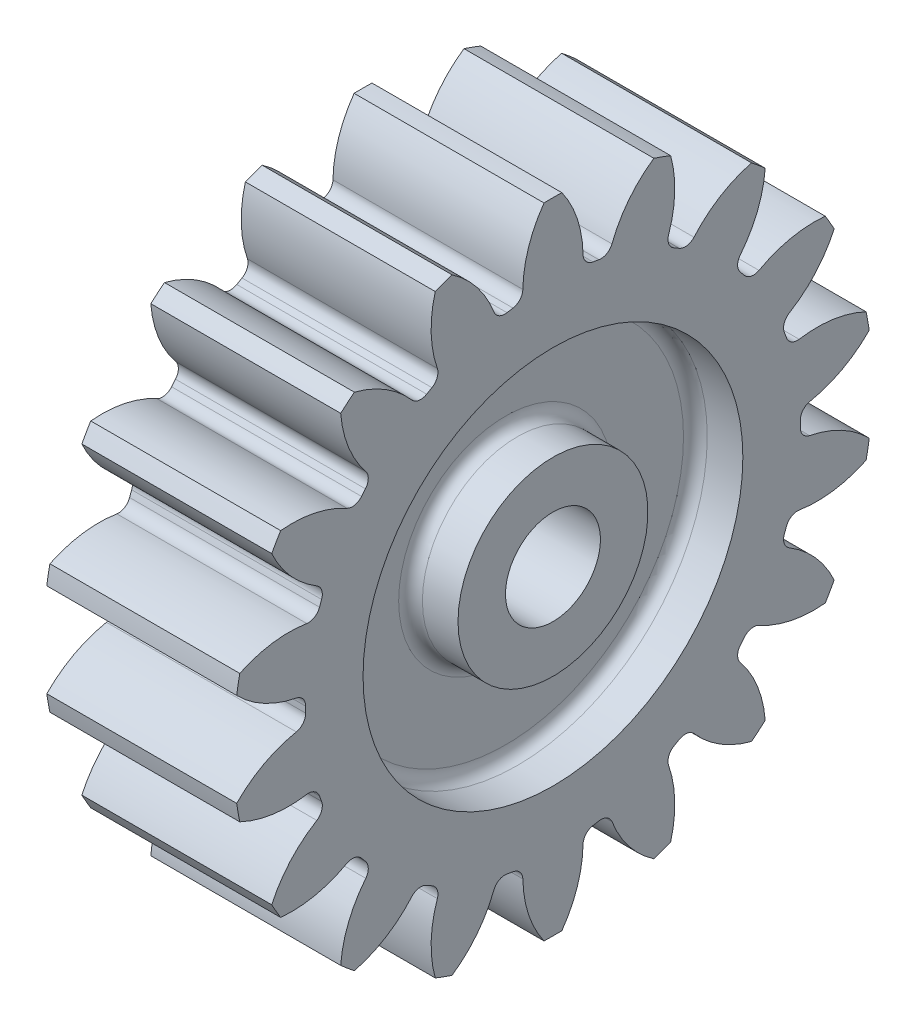
from build123d import *

# Parameters (mm, degrees)
CUT_EXTRUDE2_DEPTH      = 66.590770217
CUT_EXTRUDE2_DEPTH_BACK = 66.590770217


with BuildPart() as part:
    # Sketch1 → Revolve1 (revolve)
    with BuildSketch(Plane.XY, mode=Mode.PRIVATE) as revolve1_sk:
        with BuildLine():
            Line((12.7, 42.7609), (-12.7, 42.7609))
            Line((-12.7, 42.7609), (-12.7, 25.4))
            Line((-12.7, 25.4), (-7.9375, 25.4))
            ThreePointArc((-7.9375, 25.4), (-6.814967985, 24.935032015), (-6.35, 23.8125))
            Line((-6.35, 23.8125), (-6.35, 14.2875))
            ThreePointArc((-6.35, 14.2875), (-6.814967985, 13.164967985), (-7.9375, 12.7))
            Line((-7.9375, 12.7), (-12.7, 12.7))
            Line((-12.7, 12.7), (-12.7, 6.35))
            Line((-12.7, 6.35), (12.7, 6.35))
            Line((12.7, 6.35), (12.7, 12.7))
            Line((12.7, 12.7), (7.9375, 12.7))
            ThreePointArc((7.9375, 12.7), (6.814967985, 13.164967985), (6.35, 14.2875))
            Line((6.35, 14.2875), (6.35, 23.8125))
            ThreePointArc((6.35, 23.8125), (6.814967985, 24.935032015), (7.9375, 25.4))
            Line((7.9375, 25.4), (12.7, 25.4))
            Line((12.7, 25.4), (12.7, 42.7609))
        make_face()
    revolve(revolve1_sk.sketch.rotate(Axis((-34.982581394, 0, 0), (1, 0, 0)), 90), axis=Axis((-34.982581394, 0, 0), (1, 0, 0)))

    # Sketch2 → Cut-Extrude2 (cut, two sides: drawn at the far end of the back side and taken through both)
    with BuildSketch(Plane(origin=(12.7, 0, 0), x_dir=(0, 0, -1), z_dir=(1, 0, 0)).offset(-CUT_EXTRUDE2_DEPTH_BACK)):
        with BuildLine():
            ThreePointArc((-5.346216013, -32.6486745), (-5.744889486, -32.580887297), (-6.142704595, -32.508232073))
            ThreePointArc((-6.142704595, -32.508232073), (-7.188622848, -32.672825156), (-7.893925966, -33.462498119))
            ThreePointArc((-7.893925966, -33.462498119), (-7.904401835, -33.489776906), (-7.914929989, -33.517035556))
            ThreePointArc((-7.914929989, -33.517035556), (-10.173518502, -37.467321782), (-13.497693879, -40.574706761))
            ThreePointArc((-13.497693879, -40.574706761), (-7.42535236, -42.111265846), (-1.193683686, -42.744235729))
            ThreePointArc((-1.193683686, -42.744235729), (-3.254598502, -38.687314056), (-4.0259, -34.202776472))
            ThreePointArc((-4.0259, -34.202776472), (-4.026470221, -34.173560879), (-4.026984424, -34.144344246))
            ThreePointArc((-4.026984424, -34.144344246), (-4.419668498, -33.161066516), (-5.346216013, -32.6486745))
        make_face()
        with BuildLine():
            ThreePointArc((-16.190304069, -28.851204939), (-16.54175, -28.651151446), (-16.890724373, -28.446817088))
            ThreePointArc((-16.890724373, -28.446817088), (-17.929860187, -28.243758882), (-18.862712382, -28.744580865))
            ThreePointArc((-18.862712382, -28.744580865), (-18.881886373, -28.766631582), (-18.90110261, -28.788645494))
            ThreePointArc((-18.90110261, -28.788645494), (-22.37455903, -31.728217543), (-26.561050358, -33.511269339))
            ThreePointArc((-26.561050358, -33.511269339), (-21.38045, -37.032025689), (-15.741085382, -39.75817903))
            ThreePointArc((-15.741085382, -39.75817903), (-16.290162894, -35.24104529), (-15.481147033, -30.763157766))
            ThreePointArc((-15.481147033, -30.763157766), (-15.471690544, -30.735509061), (-15.46218106, -30.707878539))
            ThreePointArc((-15.46218106, -30.707878539), (-15.494882597, -29.649593849), (-16.190304069, -28.851204939))
        make_face()
        with BuildLine():
            ThreePointArc((-25.08160251, -21.573854264), (-25.343431334, -21.265663885), (-25.60147351, -20.954296131))
            ThreePointArc((-25.60147351, -20.954296131), (-26.50849177, -20.408078454), (-27.5563773, -20.559642934))
            ThreePointArc((-27.5563773, -20.559642934), (-27.581936748, -20.573805939), (-27.607523305, -20.587919909))
            ThreePointArc((-27.607523305, -20.587919909), (-31.876897526, -22.16222201), (-36.420752164, -22.405878261))
            ThreePointArc((-36.420752164, -22.405878261), (-32.756749828, -27.486176699), (-28.389879867, -31.976699172))
            ThreePointArc((-28.389879867, -31.976699172), (-27.360893224, -27.54418636), (-25.069139257, -23.613048218))
            ThreePointArc((-25.069139257, -23.613048218), (-25.05079665, -23.590301244), (-25.032410462, -23.567589481))
            ThreePointArc((-25.032410462, -23.567589481), (-24.701185174, -22.561942583), (-25.08160251, -21.573854264))
        make_face()
        with BuildLine():
            ThreePointArc((-30.947689523, -11.694378368), (-31.08832082, -11.315223412), (-31.224307105, -10.934377809))
            ThreePointArc((-31.224307105, -10.934377809), (-31.889808023, -10.110882573), (-32.926336428, -9.894908638))
            ThreePointArc((-32.926336428, -9.894908638), (-32.955198485, -9.899475662), (-32.984069246, -9.903987338))
            ThreePointArc((-32.984069246, -9.903987338), (-37.534411727, -9.923135422), (-41.887573746, -8.598007589))
            ThreePointArc((-41.887573746, -8.598007589), (-40.182102188, -14.625089147), (-37.61443585, -20.338357468))
            ThreePointArc((-37.61443585, -20.338357468), (-35.131496028, -16.525092046), (-31.633423305, -13.614856563))
            ThreePointArc((-31.633423305, -13.614856563), (-31.608406969, -13.59975494), (-31.583361724, -13.584701311))
            ThreePointArc((-31.583361724, -13.584701311), (-30.928160269, -12.752988062), (-30.947689523, -11.694378368))
        make_face()
        with BuildLine():
            ThreePointArc((-33.081028441, -0.404387851), (-33.0835, 0), (-33.081028441, 0.404387851))
            ThreePointArc((-33.081028441, 0.404387851), (-33.424742784, 1.405834967), (-34.324893441, 1.963297674))
            ThreePointArc((-34.324893441, 1.963297674), (-34.353576918, 1.96887748), (-34.382249643, 1.974512273))
            ThreePointArc((-34.382249643, 1.974512273), (-38.664721924, 3.512827747), (-42.302135739, 6.246909692))
            ThreePointArc((-42.302135739, 6.246909692), (-42.7609, 0), (-42.302135739, -6.246909692))
            ThreePointArc((-42.302135739, -6.246909692), (-38.664721924, -3.512827747), (-34.382249643, -1.974512273))
            ThreePointArc((-34.382249643, -1.974512273), (-34.353576918, -1.96887748), (-34.324893441, -1.963297674))
            ThreePointArc((-34.324893441, -1.963297674), (-33.424742784, -1.405834967), (-33.081028441, -0.404387851))
        make_face()
        with BuildLine():
            ThreePointArc((-31.224307105, 10.934377809), (-31.08832082, 11.315223412), (-30.947689523, 11.694378368))
            ThreePointArc((-30.947689523, 11.694378368), (-30.928160269, 12.752988062), (-31.583361724, 13.584701311))
            ThreePointArc((-31.583361724, 13.584701311), (-31.608406969, 13.59975494), (-31.633423305, 13.614856563))
            ThreePointArc((-31.633423305, 13.614856563), (-35.131496028, 16.525092046), (-37.61443585, 20.338357468))
            ThreePointArc((-37.61443585, 20.338357468), (-40.182102188, 14.625089147), (-41.887573746, 8.598007589))
            ThreePointArc((-41.887573746, 8.598007589), (-37.534411727, 9.923135422), (-32.984069246, 9.903987338))
            ThreePointArc((-32.984069246, 9.903987338), (-32.955198485, 9.899475662), (-32.926336428, 9.894908638))
            ThreePointArc((-32.926336428, 9.894908638), (-31.889808023, 10.110882573), (-31.224307105, 10.934377809))
        make_face()
        with BuildLine():
            ThreePointArc((-25.069139257, 23.613048218), (-27.360893224, 27.54418636), (-28.389879867, 31.976699172))
            ThreePointArc((-28.389879867, 31.976699172), (-32.756749828, 27.486176699), (-36.420752164, 22.405878261))
            ThreePointArc((-36.420752164, 22.405878261), (-31.876897526, 22.16222201), (-27.607523305, 20.587919909))
            ThreePointArc((-27.607523305, 20.587919909), (-27.581936748, 20.573805939), (-27.5563773, 20.559642934))
            ThreePointArc((-27.5563773, 20.559642934), (-26.50849177, 20.408078454), (-25.60147351, 20.954296131))
            ThreePointArc((-25.60147351, 20.954296131), (-25.343431334, 21.265663885), (-25.08160251, 21.573854264))
            ThreePointArc((-25.08160251, 21.573854264), (-24.701185174, 22.561942583), (-25.032410462, 23.567589481))
            ThreePointArc((-25.032410462, 23.567589481), (-25.05079665, 23.590301244), (-25.069139257, 23.613048218))
        make_face()
        with BuildLine():
            ThreePointArc((-15.481147033, 30.763157766), (-16.290162894, 35.24104529), (-15.741085382, 39.75817903))
            ThreePointArc((-15.741085382, 39.75817903), (-21.38045, 37.032025689), (-26.561050358, 33.511269339))
            ThreePointArc((-26.561050358, 33.511269339), (-22.37455903, 31.728217543), (-18.90110261, 28.788645494))
            ThreePointArc((-18.90110261, 28.788645494), (-18.881886373, 28.766631582), (-18.862712382, 28.744580865))
            ThreePointArc((-18.862712382, 28.744580865), (-17.929860187, 28.243758882), (-16.890724373, 28.446817088))
            ThreePointArc((-16.890724373, 28.446817088), (-16.54175, 28.651151446), (-16.190304069, 28.851204939))
            ThreePointArc((-16.190304069, 28.851204939), (-15.494882597, 29.649593849), (-15.46218106, 30.707878539))
            ThreePointArc((-15.46218106, 30.707878539), (-15.471690544, 30.735509061), (-15.481147033, 30.763157766))
        make_face()
        with BuildLine():
            ThreePointArc((-4.0259, 34.202776472), (-3.254598502, 38.687314056), (-1.193683686, 42.744235729))
            ThreePointArc((-1.193683686, 42.744235729), (-7.42535236, 42.111265846), (-13.497693879, 40.574706761))
            ThreePointArc((-13.497693879, 40.574706761), (-10.173518502, 37.467321782), (-7.914929989, 33.517035556))
            ThreePointArc((-7.914929989, 33.517035556), (-7.904401835, 33.489776906), (-7.893925966, 33.462498119))
            ThreePointArc((-7.893925966, 33.462498119), (-7.188622848, 32.672825156), (-6.142704595, 32.508232073))
            ThreePointArc((-6.142704595, 32.508232073), (-5.744889486, 32.580887297), (-5.346216013, 32.6486745))
            ThreePointArc((-5.346216013, 32.6486745), (-4.419668498, 33.161066516), (-4.026984424, 34.144344246))
            ThreePointArc((-4.026984424, 34.144344246), (-4.026470221, 34.173560879), (-4.0259, 34.202776472))
        make_face()
        with BuildLine():
            ThreePointArc((13.497693879, 40.574706761), (7.42535236, 42.111265846), (1.193683686, 42.744235729))
            ThreePointArc((1.193683686, 42.744235729), (3.254598502, 38.687314056), (4.0259, 34.202776472))
            ThreePointArc((4.0259, 34.202776472), (4.026470221, 34.173560879), (4.026984424, 34.144344246))
            ThreePointArc((4.026984424, 34.144344246), (4.419668498, 33.161066516), (5.346216013, 32.6486745))
            ThreePointArc((5.346216013, 32.6486745), (5.744889486, 32.580887297), (6.142704595, 32.508232073))
            ThreePointArc((6.142704595, 32.508232073), (7.188622848, 32.672825156), (7.893925966, 33.462498119))
            ThreePointArc((7.893925966, 33.462498119), (7.904401835, 33.489776906), (7.914929989, 33.517035556))
            ThreePointArc((7.914929989, 33.517035556), (10.173518502, 37.467321782), (13.497693879, 40.574706761))
        make_face()
        with BuildLine():
            ThreePointArc((26.561050358, 33.511269339), (21.38045, 37.032025689), (15.741085382, 39.75817903))
            ThreePointArc((15.741085382, 39.75817903), (16.290162894, 35.24104529), (15.481147033, 30.763157766))
            ThreePointArc((15.481147033, 30.763157766), (15.471690544, 30.735509061), (15.46218106, 30.707878539))
            ThreePointArc((15.46218106, 30.707878539), (15.494882597, 29.649593849), (16.190304069, 28.851204939))
            ThreePointArc((16.190304069, 28.851204939), (16.54175, 28.651151446), (16.890724373, 28.446817088))
            ThreePointArc((16.890724373, 28.446817088), (17.929860187, 28.243758882), (18.862712382, 28.744580865))
            ThreePointArc((18.862712382, 28.744580865), (18.881886373, 28.766631582), (18.90110261, 28.788645494))
            ThreePointArc((18.90110261, 28.788645494), (22.37455903, 31.728217543), (26.561050358, 33.511269339))
        make_face()
        with BuildLine():
            ThreePointArc((36.420752164, 22.405878261), (32.756749828, 27.486176699), (28.389879867, 31.976699172))
            ThreePointArc((28.389879867, 31.976699172), (27.360893224, 27.54418636), (25.069139257, 23.613048218))
            ThreePointArc((25.069139257, 23.613048218), (25.05079665, 23.590301244), (25.032410462, 23.567589481))
            ThreePointArc((25.032410462, 23.567589481), (24.701185174, 22.561942583), (25.08160251, 21.573854264))
            ThreePointArc((25.08160251, 21.573854264), (25.343431334, 21.265663885), (25.60147351, 20.954296131))
            ThreePointArc((25.60147351, 20.954296131), (26.50849177, 20.408078454), (27.5563773, 20.559642934))
            ThreePointArc((27.5563773, 20.559642934), (27.581936748, 20.573805939), (27.607523305, 20.587919909))
            ThreePointArc((27.607523305, 20.587919909), (31.876897526, 22.16222201), (36.420752164, 22.405878261))
        make_face()
        with BuildLine():
            ThreePointArc((31.583361724, 13.584701311), (30.928160269, 12.752988062), (30.947689523, 11.694378368))
            ThreePointArc((30.947689523, 11.694378368), (31.08832082, 11.315223412), (31.224307105, 10.934377809))
            ThreePointArc((31.224307105, 10.934377809), (31.889808023, 10.110882573), (32.926336428, 9.894908638))
            ThreePointArc((32.926336428, 9.894908638), (32.955198485, 9.899475662), (32.984069246, 9.903987338))
            ThreePointArc((32.984069246, 9.903987338), (37.534411727, 9.923135422), (41.887573746, 8.598007589))
            ThreePointArc((41.887573746, 8.598007589), (40.182102188, 14.625089147), (37.61443585, 20.338357468))
            ThreePointArc((37.61443585, 20.338357468), (35.131496028, 16.525092046), (31.633423305, 13.614856563))
            ThreePointArc((31.633423305, 13.614856563), (31.608406969, 13.59975494), (31.583361724, 13.584701311))
        make_face()
        with BuildLine():
            ThreePointArc((34.324893441, 1.963297674), (33.424742784, 1.405834967), (33.081028441, 0.404387851))
            ThreePointArc((33.081028441, 0.404387851), (33.082882104, 0.202197702), (33.0835, 0))
            ThreePointArc((33.0835, 0), (33.082882104, -0.202197702), (33.081028441, -0.404387851))
            ThreePointArc((33.081028441, -0.404387851), (33.424742784, -1.405834967), (34.324893441, -1.963297674))
            ThreePointArc((34.324893441, -1.963297674), (34.353576918, -1.96887748), (34.382249643, -1.974512273))
            ThreePointArc((34.382249643, -1.974512273), (38.664721924, -3.512827747), (42.302135739, -6.246909692))
            ThreePointArc((42.302135739, -6.246909692), (42.646054712, -3.13186627), (42.7609, 0))
            ThreePointArc((42.7609, 0), (42.646054712, 3.13186627), (42.302135739, 6.246909692))
            ThreePointArc((42.302135739, 6.246909692), (38.664721924, 3.512827747), (34.382249643, 1.974512273))
            ThreePointArc((34.382249643, 1.974512273), (34.353576918, 1.96887748), (34.324893441, 1.963297674))
        make_face()
        with BuildLine():
            ThreePointArc((32.926336428, -9.894908638), (31.889808023, -10.110882573), (31.224307105, -10.934377809))
            ThreePointArc((31.224307105, -10.934377809), (31.08832082, -11.315223412), (30.947689523, -11.694378368))
            ThreePointArc((30.947689523, -11.694378368), (30.928160269, -12.752988062), (31.583361724, -13.584701311))
            ThreePointArc((31.583361724, -13.584701311), (31.608406969, -13.59975494), (31.633423305, -13.614856563))
            ThreePointArc((31.633423305, -13.614856563), (35.131496028, -16.525092046), (37.61443585, -20.338357468))
            ThreePointArc((37.61443585, -20.338357468), (40.182102188, -14.625089147), (41.887573746, -8.598007589))
            ThreePointArc((41.887573746, -8.598007589), (37.534411727, -9.923135422), (32.984069246, -9.903987338))
            ThreePointArc((32.984069246, -9.903987338), (32.955198485, -9.899475662), (32.926336428, -9.894908638))
        make_face()
        with BuildLine():
            ThreePointArc((27.5563773, -20.559642934), (26.50849177, -20.408078454), (25.60147351, -20.954296131))
            ThreePointArc((25.60147351, -20.954296131), (25.343431334, -21.265663885), (25.08160251, -21.573854264))
            ThreePointArc((25.08160251, -21.573854264), (24.701185174, -22.561942583), (25.032410462, -23.567589481))
            ThreePointArc((25.032410462, -23.567589481), (25.05079665, -23.590301244), (25.069139257, -23.613048218))
            ThreePointArc((25.069139257, -23.613048218), (27.360893224, -27.54418636), (28.389879867, -31.976699172))
            ThreePointArc((28.389879867, -31.976699172), (32.756749828, -27.486176699), (36.420752164, -22.405878261))
            ThreePointArc((36.420752164, -22.405878261), (31.876897526, -22.16222201), (27.607523305, -20.587919909))
            ThreePointArc((27.607523305, -20.587919909), (27.581936748, -20.573805939), (27.5563773, -20.559642934))
        make_face()
        with BuildLine():
            ThreePointArc((18.862712382, -28.744580865), (17.929860187, -28.243758882), (16.890724373, -28.446817088))
            ThreePointArc((16.890724373, -28.446817088), (16.54175, -28.651151446), (16.190304069, -28.851204939))
            ThreePointArc((16.190304069, -28.851204939), (15.494882597, -29.649593849), (15.46218106, -30.707878539))
            ThreePointArc((15.46218106, -30.707878539), (15.471690544, -30.735509061), (15.481147033, -30.763157766))
            ThreePointArc((15.481147033, -30.763157766), (16.290162894, -35.24104529), (15.741085382, -39.75817903))
            ThreePointArc((15.741085382, -39.75817903), (21.38045, -37.032025689), (26.561050358, -33.511269339))
            ThreePointArc((26.561050358, -33.511269339), (22.37455903, -31.728217543), (18.90110261, -28.788645494))
            ThreePointArc((18.90110261, -28.788645494), (18.881886373, -28.766631582), (18.862712382, -28.744580865))
        make_face()
        with BuildLine():
            ThreePointArc((7.893925966, -33.462498119), (7.188622848, -32.672825156), (6.142704595, -32.508232073))
            ThreePointArc((6.142704595, -32.508232073), (5.744889486, -32.580887297), (5.346216013, -32.6486745))
            ThreePointArc((5.346216013, -32.6486745), (4.419668498, -33.161066516), (4.026984424, -34.144344246))
            ThreePointArc((4.026984424, -34.144344246), (4.026470221, -34.173560879), (4.0259, -34.202776472))
            ThreePointArc((4.0259, -34.202776472), (3.254598502, -38.687314056), (1.193683686, -42.744235729))
            ThreePointArc((1.193683686, -42.744235729), (7.42535236, -42.111265846), (13.497693879, -40.574706761))
            ThreePointArc((13.497693879, -40.574706761), (10.173518502, -37.467321782), (7.914929989, -33.517035556))
            ThreePointArc((7.914929989, -33.517035556), (7.904401835, -33.489776906), (7.893925966, -33.462498119))
        make_face()
    extrude(amount=CUT_EXTRUDE2_DEPTH + CUT_EXTRUDE2_DEPTH_BACK, mode=Mode.SUBTRACT)


solid = part.part
